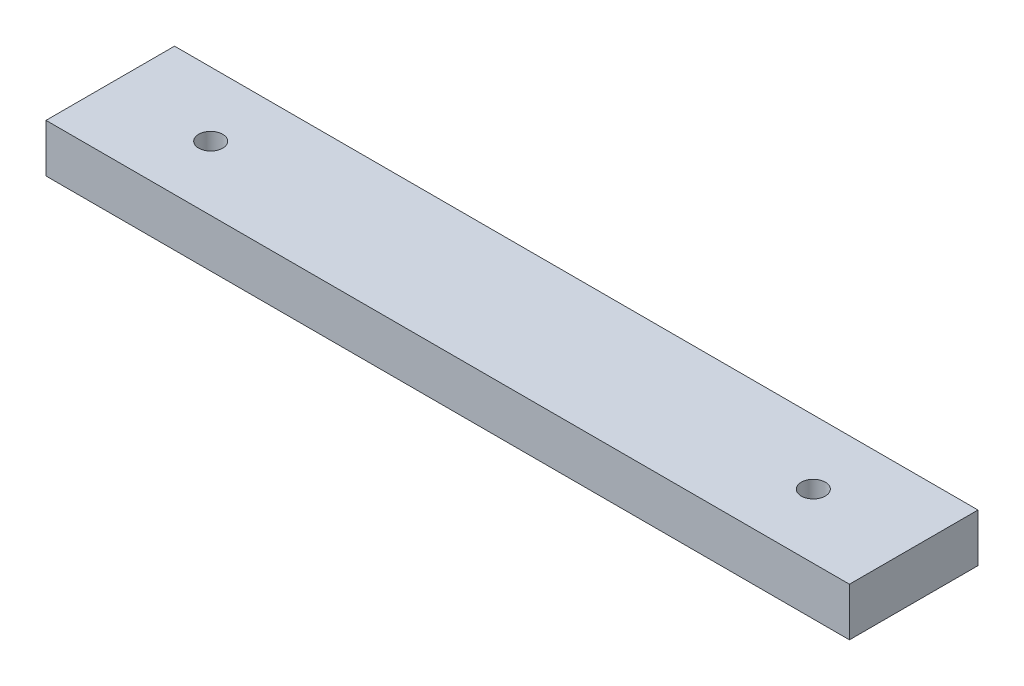
from build123d import *

# Parameters (mm, degrees)
SKETCH_1_W      = 100
SKETCH_1_H      = 16
SKETCH_1_R      = 1.5
EXTRUDE_1_DEPTH = 6


with BuildPart() as part:
    # 草圖1 → 填料-伸長1 (new body)
    with BuildSketch(Plane(origin=(0, 0, 0), x_dir=(1, 0, 0), z_dir=(0, 1, 0))):
        Rectangle(SKETCH_1_W, SKETCH_1_H)
        with Locations(Location((-37.5, 0, 0), (0, 0, 270))):
            Circle(SKETCH_1_R, mode=Mode.SUBTRACT)
        with Locations(Location((37.5, 0, 0), (0, 0, 270))):
            Circle(SKETCH_1_R, mode=Mode.SUBTRACT)
    extrude(amount=EXTRUDE_1_DEPTH)


solid = part.part
